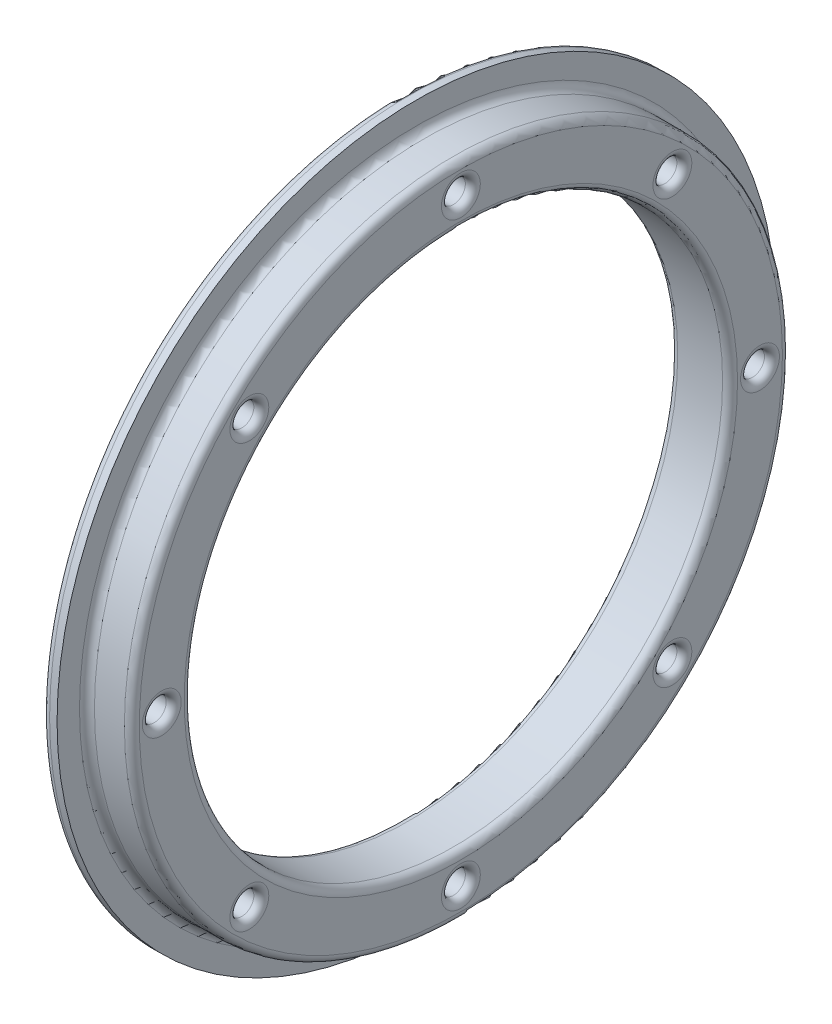
from build123d import *

# Parameters (mm, degrees)
SKETCH1_R           = 34.925
SKETCH1_R_2         = 28.575
SKETCH1_R_3         = 1.27
BOSS_EXTRUDE1_DEPTH = 3.175
BOSS_EXTRUDE2_START = -1.5875
SKETCH2_R           = 38.1
SKETCH2_R_2         = 34.925
BOSS_EXTRUDE2_DEPTH = 1.5875
FILLET1_R           = 0.79375


with BuildPart() as part:
    # Sketch1 → Boss-Extrude1 (new, symmetric)
    with BuildSketch(Plane(origin=(0, 0, 0), x_dir=(0, 0, -1), z_dir=(1, 0, 0))):
        Circle(SKETCH1_R)
        Circle(SKETCH1_R_2, mode=Mode.SUBTRACT)
        with Locations((-31.75, 0)):
            Circle(SKETCH1_R_3, mode=Mode.SUBTRACT)
        with Locations((-22.450640303, 22.450640303)):
            Circle(SKETCH1_R_3, mode=Mode.SUBTRACT)
        with Locations((0, 31.75)):
            Circle(SKETCH1_R_3, mode=Mode.SUBTRACT)
        with Locations((22.450640303, 22.450640303)):
            Circle(SKETCH1_R_3, mode=Mode.SUBTRACT)
        with Locations((31.75, 0)):
            Circle(SKETCH1_R_3, mode=Mode.SUBTRACT)
        with Locations((22.450640303, -22.450640303)):
            Circle(SKETCH1_R_3, mode=Mode.SUBTRACT)
        with Locations((0, -31.75)):
            Circle(SKETCH1_R_3, mode=Mode.SUBTRACT)
        with Locations((-22.450640303, -22.450640303)):
            Circle(SKETCH1_R_3, mode=Mode.SUBTRACT)
    extrude(amount=BOSS_EXTRUDE1_DEPTH, both=True)

    # Sketch2 → Boss-Extrude2 (add)
    with BuildSketch(Plane.ZY.offset(3.175).offset(BOSS_EXTRUDE2_START)):
        Circle(SKETCH2_R)
        Circle(SKETCH2_R_2, mode=Mode.SUBTRACT)
    extrude(amount=BOSS_EXTRUDE2_DEPTH)

    # Fillet1
    fillet1_edges = [part.edges().sort_by_distance(p)[0] for p in [
        (-3.175, 22.450640303, 23.720640303),
        (3.175, 22.450640303, 23.720640303),
        (-3.175, 31.75, 1.27),
        (3.175, 31.75, 1.27),
        (-3.175, 22.450640303, -21.180640303),
        (3.175, 22.450640303, -21.180640303),
        (-3.175, 0, -30.48),
        (3.175, 0, -30.48),
        (-3.175, -22.450640303, -21.180640303),
        (3.175, -22.450640303, -21.180640303),
        (-3.175, -31.75, 1.27),
        (3.175, -31.75, 1.27),
        (-3.175, -22.450640303, 23.720640303),
        (3.175, -22.450640303, 23.720640303),
        (-1.5875, 0, 34.925),
        (-3.175, 0, -38.1),
        (3.175, 0, 34.925),
        (-3.175, 0, 28.575),
        (3.175, 0, 28.575),
        (-3.175, 0, 33.02),
        (3.175, 0, 33.02),
    ]]
    fillet(fillet1_edges, radius=FILLET1_R)


solid = part.part
